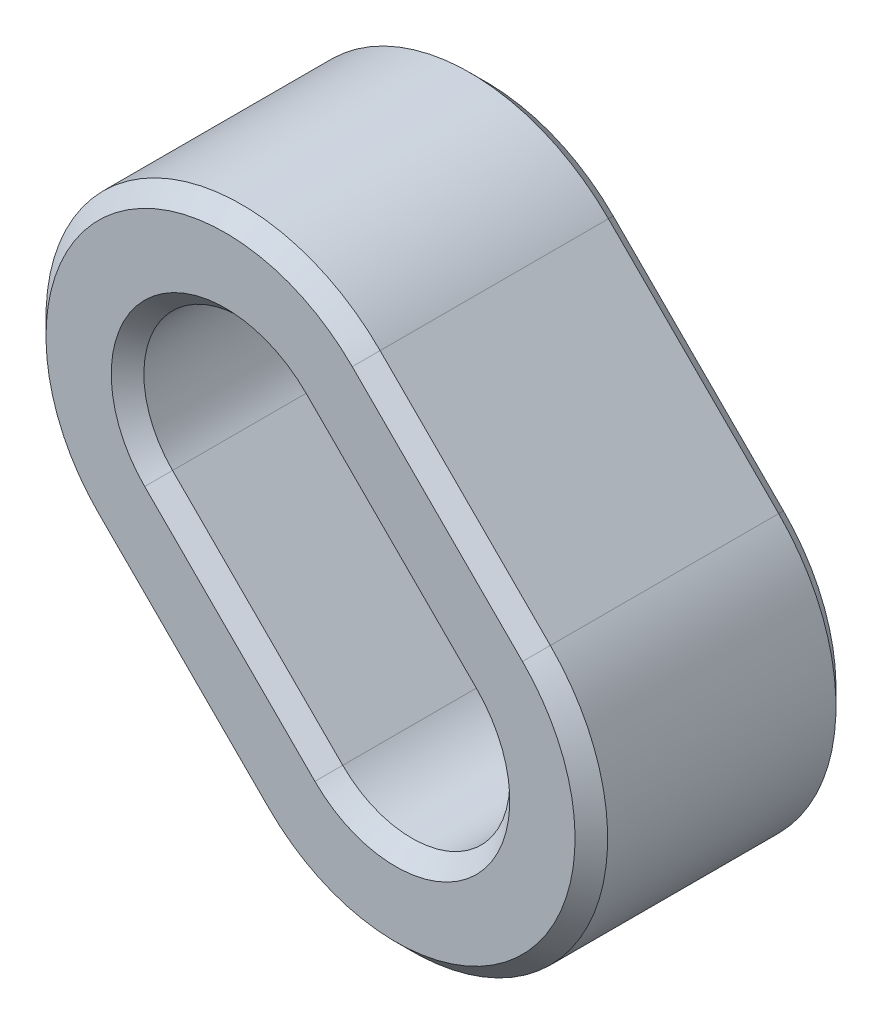
from build123d import *

# Parameters (mm, degrees)
BOSS_EXTRUDE1_DEPTH = 8
CHAMFER1_SIZE       = 0.5


with BuildPart() as part:
    # Sketch1 → Boss-Extrude1 (new body)
    with BuildSketch(Plane.XY):
        with BuildLine():
            Line((69.900235992, 117.557359313), (75.118684037, 112.338911268))
            ThreePointArc((75.118684037, 112.338911268), (83.603965411, 112.338911268), (83.603965411, 120.824192642))
            Line((83.603965411, 120.824192642), (78.385517366, 126.042640687))
            ThreePointArc((78.385517366, 126.042640687), (69.900235992, 126.042640687), (69.900235992, 117.557359313))
        make_face()
        with BuildLine():
            Line((72.021556335, 119.678679656), (77.24000438, 114.460231611))
            ThreePointArc((77.24000438, 114.460231611), (81.482645068, 114.460231611), (81.482645068, 118.702872298))
            Line((81.482645068, 118.702872298), (76.264197022, 123.921320344))
            ThreePointArc((76.264197022, 123.921320344), (72.021556335, 123.921320344), (72.021556335, 119.678679656))
        make_face(mode=Mode.SUBTRACT)
    extrude(amount=BOSS_EXTRUDE1_DEPTH)

    # Chamfer1
    chamfer1_edges = [part.edges().sort_by_distance(p)[0] for p in [
        (83.603965411, 112.338911268, 8),
        (80.994741388, 123.433416665, 8),
        (72.021556335, 123.921320344, 0),
        (74.630780358, 117.069455634, 0),
        (81.482645068, 114.460231611, 0),
        (78.873421045, 121.312096321, 0),
        (72.021556335, 123.921320344, 8),
        (74.630780358, 117.069455634, 8),
        (81.482645068, 114.460231611, 8),
        (78.873421045, 121.312096321, 8),
        (69.900235992, 126.042640687, 8),
        (80.994741388, 123.433416665, 0),
        (83.603965411, 112.338911268, 0),
        (72.509460014, 114.94813529, 0),
        (69.900235992, 126.042640687, 0),
        (72.509460014, 114.94813529, 8),
    ]]
    chamfer(chamfer1_edges, length=CHAMFER1_SIZE)


solid = part.part
